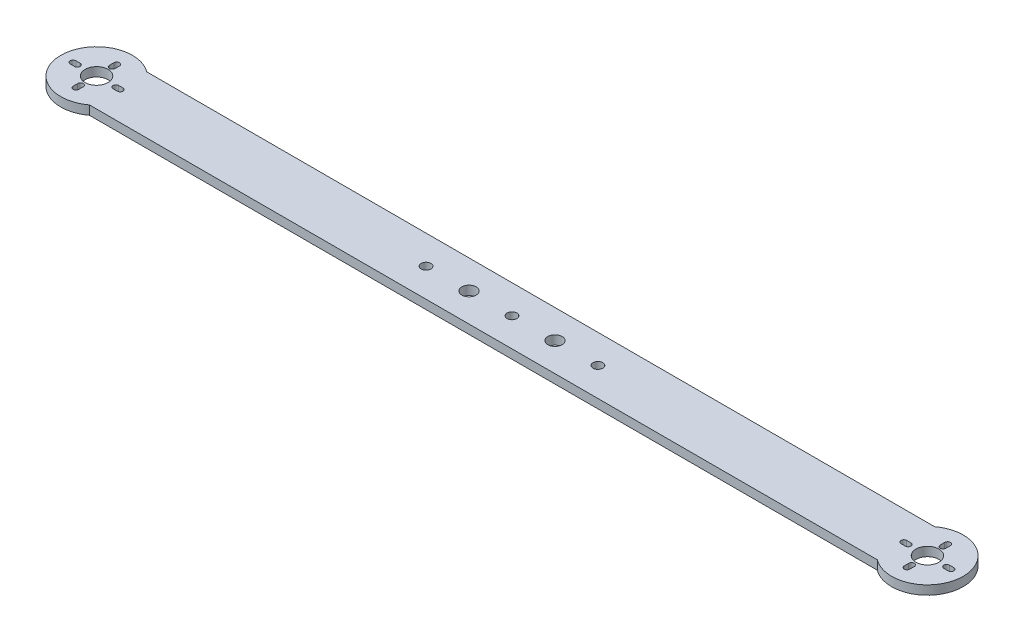
from build123d import *

# Parameters (mm, degrees)
BOSS_EXTRUDE1_DEPTH = 4
SKETCH2_R           = 5.08
CUT_EXTRUDE1_DEPTH  = 201.6938371
SKETCH3_R           = 2.159
CUT_EXTRUDE2_DEPTH  = 201.6938371
SKETCH4_R           = 3.175
CUT_EXTRUDE3_DEPTH  = 201.6938371


with BuildPart() as part:
    # Sketch1 → Boss-Extrude1 (new body)
    with BuildSketch(Plane(origin=(0, 0, 0), x_dir=(1, 0, 0), z_dir=(0, 1, 0))):
        with BuildLine():
            Line((-174.625, 12.7), (174.625, 12.7))
            ThreePointArc((174.625, 12.7), (200.025, 0), (174.625, -12.7))
            Line((174.625, -12.7), (-174.625, -12.7))
            ThreePointArc((-174.625, -12.7), (-200.025, 0), (-174.625, 12.7))
        make_face()
    extrude(amount=BOSS_EXTRUDE1_DEPTH)

    # Sketch2 → Cut-Extrude1 (cut, through all)
    with BuildSketch(Plane(origin=(0, 4, 0), x_dir=(1, 0, 0), z_dir=(0, 1, 0))):
        with Locations(Location((184.15, 0, 0), (0, 0, 270))):
            Circle(SKETCH2_R)
        with Locations(Location((-184.15, 0, 0), (0, 0, 90))):
            Circle(SKETCH2_R)
        with BuildLine():
            Line((173.691383345, 1.25), (175.608616655, 1.25))
            ThreePointArc((175.608616655, 1.25), (176.858616655, 0), (175.608616655, -1.25))
            Line((175.608616655, -1.25), (173.691383345, -1.25))
            ThreePointArc((173.691383345, -1.25), (172.441383345, 0), (173.691383345, 1.25))
        make_face()
        with BuildLine():
            Line((194.608616655, 1.25), (192.691383345, 1.25))
            ThreePointArc((192.691383345, 1.25), (191.441383345, 0), (192.691383345, -1.25))
            Line((192.691383345, -1.25), (194.608616655, -1.25))
            ThreePointArc((194.608616655, -1.25), (195.858616655, 0), (194.608616655, 1.25))
        make_face()
        with BuildLine():
            Line((185.4, 8.920928665), (185.4, 6.921035691))
            ThreePointArc((185.4, 6.921035691), (184.15, 5.671035691), (182.9, 6.921035691))
            Line((182.9, 6.921035691), (182.9, 8.920928665))
            ThreePointArc((182.9, 8.920928665), (184.15, 10.170928665), (185.4, 8.920928665))
        make_face()
        with BuildLine():
            Line((185.441381345, -9.078964309), (185.441381345, -7.078964309))
            ThreePointArc((185.441381345, -7.078964309), (184.191381345, -5.828964309), (182.941381345, -7.078964309))
            Line((182.941381345, -7.078964309), (182.941381345, -9.078964309))
            ThreePointArc((182.941381345, -9.078964309), (184.191381345, -10.328964309), (185.441381345, -9.078964309))
        make_face()
        with BuildLine():
            Line((-185.441381345, -9.078964309), (-185.441381345, -7.078964309))
            ThreePointArc((-185.441381345, -7.078964309), (-184.191381345, -5.828964309), (-182.941381345, -7.078964309))
            Line((-182.941381345, -7.078964309), (-182.941381345, -9.078964309))
            ThreePointArc((-182.941381345, -9.078964309), (-184.191381345, -10.328964309), (-185.441381345, -9.078964309))
        make_face()
        with BuildLine():
            Line((-185.4, 8.920928665), (-185.4, 6.921035691))
            ThreePointArc((-185.4, 6.921035691), (-184.15, 5.671035691), (-182.9, 6.921035691))
            Line((-182.9, 6.921035691), (-182.9, 8.920928665))
            ThreePointArc((-182.9, 8.920928665), (-184.15, 10.170928665), (-185.4, 8.920928665))
        make_face()
        with BuildLine():
            Line((-194.608616655, 1.25), (-192.691383345, 1.25))
            ThreePointArc((-192.691383345, 1.25), (-191.441383345, 0), (-192.691383345, -1.25))
            Line((-192.691383345, -1.25), (-194.608616655, -1.25))
            ThreePointArc((-194.608616655, -1.25), (-195.858616655, 0), (-194.608616655, 1.25))
        make_face()
        with BuildLine():
            Line((-173.691383345, 1.25), (-175.608616655, 1.25))
            ThreePointArc((-175.608616655, 1.25), (-176.858616655, 0), (-175.608616655, -1.25))
            Line((-175.608616655, -1.25), (-173.691383345, -1.25))
            ThreePointArc((-173.691383345, -1.25), (-172.441383345, 0), (-173.691383345, 1.25))
        make_face()
    extrude(amount=-CUT_EXTRUDE1_DEPTH, mode=Mode.SUBTRACT)

    # Sketch3 → Cut-Extrude2 (cut, through all)
    with BuildSketch(Plane(origin=(0, 4, 0), x_dir=(1, 0, 0), z_dir=(0, 1, 0))):
        with Locations(Location((0, 0, 0), (0, 0, 270))):
            Circle(SKETCH3_R)
        with Locations(Location((38.1, 0, 0), (0, 0, 270))):
            Circle(SKETCH3_R)
        with Locations(Location((-38.1, 0, 0), (0, 0, 270))):
            Circle(SKETCH3_R)
    extrude(amount=-CUT_EXTRUDE2_DEPTH, mode=Mode.SUBTRACT)

    # Sketch4 → Cut-Extrude3 (cut, through all)
    with BuildSketch(Plane(origin=(0, 4, 0), x_dir=(1, 0, 0), z_dir=(0, 1, 0))):
        with Locations(Location((-19.05, 0, 0), (0, 0, 270))):
            Circle(SKETCH4_R)
        with Locations(Location((19.05, 0, 0), (0, 0, 270))):
            Circle(SKETCH4_R)
    extrude(amount=-CUT_EXTRUDE3_DEPTH, mode=Mode.SUBTRACT)


solid = part.part
